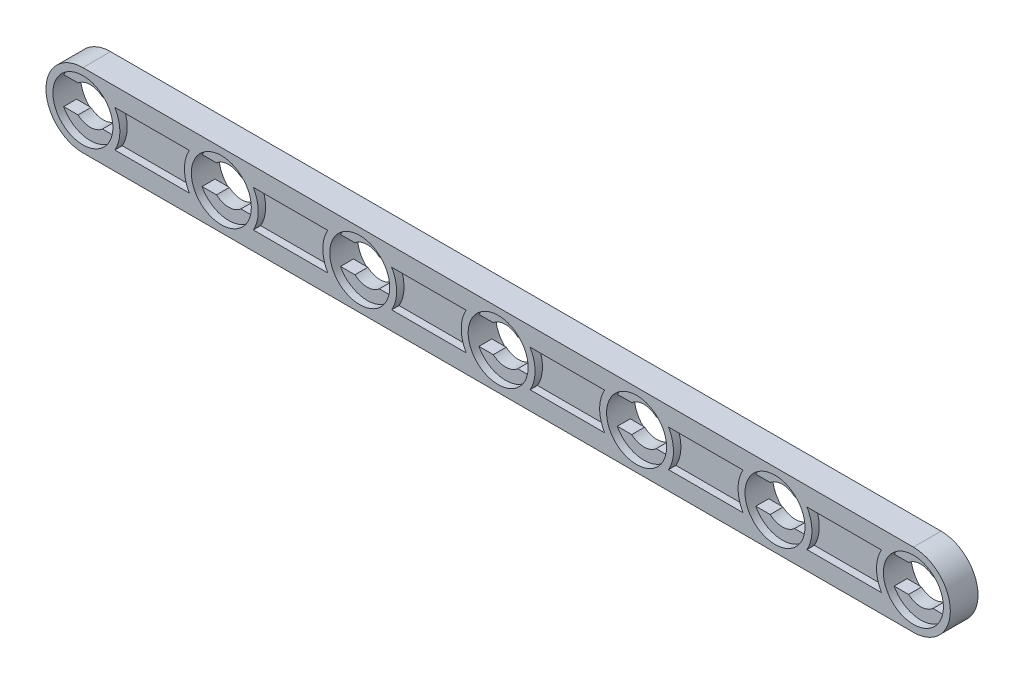
from build123d import *

# Parameters (mm, degrees)
EXTRUDE_1_DEPTH          = 3
CUT_EXTRUDE_1_REACH      = 96.133
SKETCH_3_R               = 3.25
CUT_EXTRUDE_2_DEPTH      = 0.8
CUT_EXTRUDE_START        = -2.2
SKETCH_3_2_R             = 3.25
CUT_EXTRUDE_3_DEPTH      = 0.8
CUT_EXTRUDE_4_DEPTH      = 0.8
SKETCH_5_W               = 7
SKETCH_5_H               = 4
CUT_EXTRUDE_6_DEPTH      = 0.8
MIRROR_8_COPY_1_REACH    = 96.133
MIRROR_8_COPY_2_SKETCH_R = 3.25
MIRROR_8_COPY_2_DEPTH    = 0.8
MIRROR_START             = -2.2
MIRROR_8_COPY_3_SKETCH_R = 3.25
MIRROR_8_COPY_3_DEPTH    = 0.8
MIRROR_8_COPY_4_DEPTH    = 0.8
MIRROR_8_COPY_5_SKETCH_W = 7
MIRROR_8_COPY_5_SKETCH_H = 4
MIRROR_8_COPY_5_DEPTH    = 0.8
MIRROR_8_COPY_6_REACH    = 96.133
MIRROR_8_COPY_7_SKETCH_R = 3.25
MIRROR_8_COPY_7_DEPTH    = 0.8
MIRROR_8_COPY_8_SKETCH_R = 3.25
MIRROR_8_COPY_8_DEPTH    = 0.8


with BuildPart() as part:
    # 草图1 → 凸台-拉伸1 (new body)
    with BuildSketch(Plane.XY):
        with BuildLine():
            Line((0, 4), (90, 4))
            ThreePointArc((90, 4), (94, 0), (90, -4))
            Line((90, -4), (0, -4))
            ThreePointArc((0, -4), (-4, 0), (0, 4))
        make_face()
    extrude(amount=-EXTRUDE_1_DEPTH)

    # 草图2 → 切除-拉伸1 (cut, up to next)
    with BuildSketch(Plane.XY, mode=Mode.PRIVATE) as cut_extrude_1_sk1:
        with BuildLine():
            Line((1.322875656, -1.5), (2.883140649, -1.5))
            ThreePointArc((2.883140649, -1.5), (3.25, 0), (2.883140649, 1.5))
            Line((2.883140649, 1.5), (1.322875656, 1.5))
            ThreePointArc((1.322875656, 1.5), (0, 2), (-1.322875656, 1.5))
            Line((-1.322875656, 1.5), (-2.883140649, 1.5))
            ThreePointArc((-2.883140649, 1.5), (-3.25, 0), (-2.883140649, -1.5))
            Line((-2.883140649, -1.5), (-1.322875656, -1.5))
            ThreePointArc((-1.322875656, -1.5), (0, -2), (1.322875656, -1.5))
        make_face()
    cut_extrude_1_tool1 = extrude(cut_extrude_1_sk1.sketch, amount=-CUT_EXTRUDE_1_REACH, mode=Mode.PRIVATE) & part.part
    cut_extrude_1 = cut_extrude_1_tool1.solids().sort_by_distance((0, 0, 0))[0]
    add(cut_extrude_1, mode=Mode.SUBTRACT)

    # 草图3 → 切除-拉伸2 (cut)
    with BuildSketch(Plane.XY):
        Circle(SKETCH_3_R)
    cut_extrude_2 = extrude(amount=-CUT_EXTRUDE_2_DEPTH, mode=Mode.SUBTRACT)

    # 草图3<2> → 切除-拉伸3 (cut)
    with BuildSketch(Plane.XY.offset(CUT_EXTRUDE_START)):
        Circle(SKETCH_3_2_R)
    cut_extrude_3 = extrude(amount=-CUT_EXTRUDE_3_DEPTH, mode=Mode.SUBTRACT)

    # 草图4 → 切除-拉伸4 (cut)
    with BuildSketch(Plane.XY):
        with BuildLine():
            Line((3.464101615, 2), (11.535898385, 2))
            ThreePointArc((11.535898385, 2), (11, 0), (11.535898385, -2))
            Line((11.535898385, -2), (3.464101615, -2))
            ThreePointArc((3.464101615, -2), (4, 0), (3.464101615, 2))
        make_face()
    cut_extrude_4 = extrude(amount=-CUT_EXTRUDE_4_DEPTH, mode=Mode.SUBTRACT)

    # 草图5 → 切除-拉伸6 (cut)
    with BuildSketch(Plane(origin=(0, 0, -3), x_dir=(-1, 0, 0), z_dir=(0, 0, -1))):
        with Locations((-7.5, 0)):
            Rectangle(SKETCH_5_W, SKETCH_5_H)
    cut_extrude_6 = extrude(amount=-CUT_EXTRUDE_6_DEPTH, mode=Mode.SUBTRACT)

    # 镜向1: 切除-拉伸1, 切除-拉伸2, 切除-拉伸3 across plane
    add(cut_extrude_1.mirror(Plane(origin=(7.5, 0, 0), x_dir=(0, 0, 1), z_dir=(1, 0, 0))), mode=Mode.SUBTRACT)
    add(cut_extrude_2.mirror(Plane(origin=(7.5, 0, 0), x_dir=(0, 0, 1), z_dir=(1, 0, 0))), mode=Mode.SUBTRACT)
    add(cut_extrude_3.mirror(Plane(origin=(7.5, 0, 0), x_dir=(0, 0, 1), z_dir=(1, 0, 0))), mode=Mode.SUBTRACT)

    # 镜向3: 切除-拉伸4, 切除-拉伸6 across plane
    add(cut_extrude_4.mirror(Plane(origin=(15, 0, 0), x_dir=(0, 0, 1), z_dir=(1, 0, 0))), mode=Mode.SUBTRACT)
    add(cut_extrude_6.mirror(Plane(origin=(15, 0, 0), x_dir=(0, 0, 1), z_dir=(1, 0, 0))), mode=Mode.SUBTRACT)

    # 镜向4: 切除-拉伸4, 切除-拉伸6 across plane
    add(cut_extrude_4.mirror(Plane(origin=(22.5, 0, 0), x_dir=(0, 0, 1), z_dir=(1, 0, 0))), mode=Mode.SUBTRACT)
    add(cut_extrude_6.mirror(Plane(origin=(22.5, 0, 0), x_dir=(0, 0, 1), z_dir=(1, 0, 0))), mode=Mode.SUBTRACT)

    # 镜向7: 切除-拉伸1, 切除-拉伸2, 切除-拉伸3 across plane
    add(cut_extrude_1.mirror(Plane(origin=(15, 0, 0), x_dir=(0, 0, 1), z_dir=(1, 0, 0))), mode=Mode.SUBTRACT)
    add(cut_extrude_2.mirror(Plane(origin=(15, 0, 0), x_dir=(0, 0, 1), z_dir=(1, 0, 0))), mode=Mode.SUBTRACT)
    add(cut_extrude_3.mirror(Plane(origin=(15, 0, 0), x_dir=(0, 0, 1), z_dir=(1, 0, 0))), mode=Mode.SUBTRACT)

    # 镜向8: 切除-拉伸1, 切除-拉伸2, 切除-拉伸3, 切除-拉伸4, 切除-拉伸6 across plane
    add(cut_extrude_1.mirror(Plane(origin=(37.5, 0, 0), x_dir=(0, 0, 1), z_dir=(1, 0, 0))), mode=Mode.SUBTRACT)
    add(cut_extrude_2.mirror(Plane(origin=(37.5, 0, 0), x_dir=(0, 0, 1), z_dir=(1, 0, 0))), mode=Mode.SUBTRACT)
    add(cut_extrude_3.mirror(Plane(origin=(37.5, 0, 0), x_dir=(0, 0, 1), z_dir=(1, 0, 0))), mode=Mode.SUBTRACT)
    add(cut_extrude_4.mirror(Plane(origin=(37.5, 0, 0), x_dir=(0, 0, 1), z_dir=(1, 0, 0))), mode=Mode.SUBTRACT)
    add(cut_extrude_6.mirror(Plane(origin=(37.5, 0, 0), x_dir=(0, 0, 1), z_dir=(1, 0, 0))), mode=Mode.SUBTRACT)

    # 镜向8 copy 1 sketch → 镜向8 copy 1 (cut, up to next)
    with BuildSketch(Plane(origin=(60, 0, 0), x_dir=(1, 0, 0), z_dir=(0, 0, 1)), mode=Mode.PRIVATE) as mirror_8_copy_1_sk1:
        with BuildLine():
            Line((1.322875656, -1.5), (2.883140649, -1.5))
            ThreePointArc((2.883140649, -1.5), (3.25, 0), (2.883140649, 1.5))
            Line((2.883140649, 1.5), (1.322875656, 1.5))
            ThreePointArc((1.322875656, 1.5), (0, 2), (-1.322875656, 1.5))
            Line((-1.322875656, 1.5), (-2.883140649, 1.5))
            ThreePointArc((-2.883140649, 1.5), (-3.25, 0), (-2.883140649, -1.5))
            Line((-2.883140649, -1.5), (-1.322875656, -1.5))
            ThreePointArc((-1.322875656, -1.5), (0, -2), (1.322875656, -1.5))
        make_face()
    mirror_8_copy_1_tool1 = extrude(mirror_8_copy_1_sk1.sketch, amount=-MIRROR_8_COPY_1_REACH, mode=Mode.PRIVATE) & part.part
    add(mirror_8_copy_1_tool1.solids().sort_by_distance((60, 0, 0))[0], mode=Mode.SUBTRACT)

    # 镜向8 copy 2 sketch → 镜向8 copy 2 (cut)
    with BuildSketch(Plane(origin=(60, 0, 0), x_dir=(1, 0, 0), z_dir=(0, 0, 1))):
        Circle(MIRROR_8_COPY_2_SKETCH_R)
    extrude(amount=-MIRROR_8_COPY_2_DEPTH, mode=Mode.SUBTRACT)

    # 镜向8 copy 3 sketch → 镜向8 copy 3 (cut)
    with BuildSketch(Plane(origin=(60, 0, 0), x_dir=(1, 0, 0), z_dir=(0, 0, 1)).offset(MIRROR_START)):
        Circle(MIRROR_8_COPY_3_SKETCH_R)
    extrude(amount=-MIRROR_8_COPY_3_DEPTH, mode=Mode.SUBTRACT)

    # 镜向8 copy 4 sketch → 镜向8 copy 4 (cut)
    with BuildSketch(Plane(origin=(45, 0, 0), x_dir=(1, 0, 0), z_dir=(0, 0, 1))):
        with BuildLine():
            Line((3.464101615, 2), (11.535898385, 2))
            ThreePointArc((11.535898385, 2), (11, 0), (11.535898385, -2))
            Line((11.535898385, -2), (3.464101615, -2))
            ThreePointArc((3.464101615, -2), (4, 0), (3.464101615, 2))
        make_face()
    extrude(amount=-MIRROR_8_COPY_4_DEPTH, mode=Mode.SUBTRACT)

    # 镜向8 copy 5 sketch → 镜向8 copy 5 (cut)
    with BuildSketch(Plane(origin=(45, 0, -3), x_dir=(-1, 0, 0), z_dir=(0, 0, -1))):
        with Locations((-7.5, 0)):
            Rectangle(MIRROR_8_COPY_5_SKETCH_W, MIRROR_8_COPY_5_SKETCH_H)
    extrude(amount=-MIRROR_8_COPY_5_DEPTH, mode=Mode.SUBTRACT)

    # 镜向8 copy 6 sketch → 镜向8 copy 6 (cut, up to next)
    with BuildSketch(Plane(origin=(45, 0, 0), x_dir=(1, 0, 0), z_dir=(0, 0, 1)), mode=Mode.PRIVATE) as mirror_8_copy_6_sk1:
        with BuildLine():
            Line((1.322875656, -1.5), (2.883140649, -1.5))
            ThreePointArc((2.883140649, -1.5), (3.25, 0), (2.883140649, 1.5))
            Line((2.883140649, 1.5), (1.322875656, 1.5))
            ThreePointArc((1.322875656, 1.5), (0, 2), (-1.322875656, 1.5))
            Line((-1.322875656, 1.5), (-2.883140649, 1.5))
            ThreePointArc((-2.883140649, 1.5), (-3.25, 0), (-2.883140649, -1.5))
            Line((-2.883140649, -1.5), (-1.322875656, -1.5))
            ThreePointArc((-1.322875656, -1.5), (0, -2), (1.322875656, -1.5))
        make_face()
    mirror_8_copy_6_tool1 = extrude(mirror_8_copy_6_sk1.sketch, amount=-MIRROR_8_COPY_6_REACH, mode=Mode.PRIVATE) & part.part
    add(mirror_8_copy_6_tool1.solids().sort_by_distance((45, 0, 0))[0], mode=Mode.SUBTRACT)

    # 镜向8 copy 7 sketch → 镜向8 copy 7 (cut)
    with BuildSketch(Plane(origin=(45, 0, 0), x_dir=(1, 0, 0), z_dir=(0, 0, 1))):
        Circle(MIRROR_8_COPY_7_SKETCH_R)
    extrude(amount=-MIRROR_8_COPY_7_DEPTH, mode=Mode.SUBTRACT)

    # 镜向8 copy 8 sketch → 镜向8 copy 8 (cut)
    with BuildSketch(Plane(origin=(45, 0, 0), x_dir=(1, 0, 0), z_dir=(0, 0, 1)).offset(MIRROR_START)):
        Circle(MIRROR_8_COPY_8_SKETCH_R)
    extrude(amount=-MIRROR_8_COPY_8_DEPTH, mode=Mode.SUBTRACT)

    # 镜向9: 切除-拉伸1, 切除-拉伸2, 切除-拉伸3, 切除-拉伸4, 切除-拉伸6 across plane
    add(cut_extrude_1.mirror(Plane(origin=(45, 0, 0), x_dir=(0, 0, 1), z_dir=(1, 0, 0))), mode=Mode.SUBTRACT)
    add(cut_extrude_2.mirror(Plane(origin=(45, 0, 0), x_dir=(0, 0, 1), z_dir=(1, 0, 0))), mode=Mode.SUBTRACT)
    add(cut_extrude_3.mirror(Plane(origin=(45, 0, 0), x_dir=(0, 0, 1), z_dir=(1, 0, 0))), mode=Mode.SUBTRACT)
    add(cut_extrude_4.mirror(Plane(origin=(45, 0, 0), x_dir=(0, 0, 1), z_dir=(1, 0, 0))), mode=Mode.SUBTRACT)
    add(cut_extrude_6.mirror(Plane(origin=(45, 0, 0), x_dir=(0, 0, 1), z_dir=(1, 0, 0))), mode=Mode.SUBTRACT)


solid = part.part
